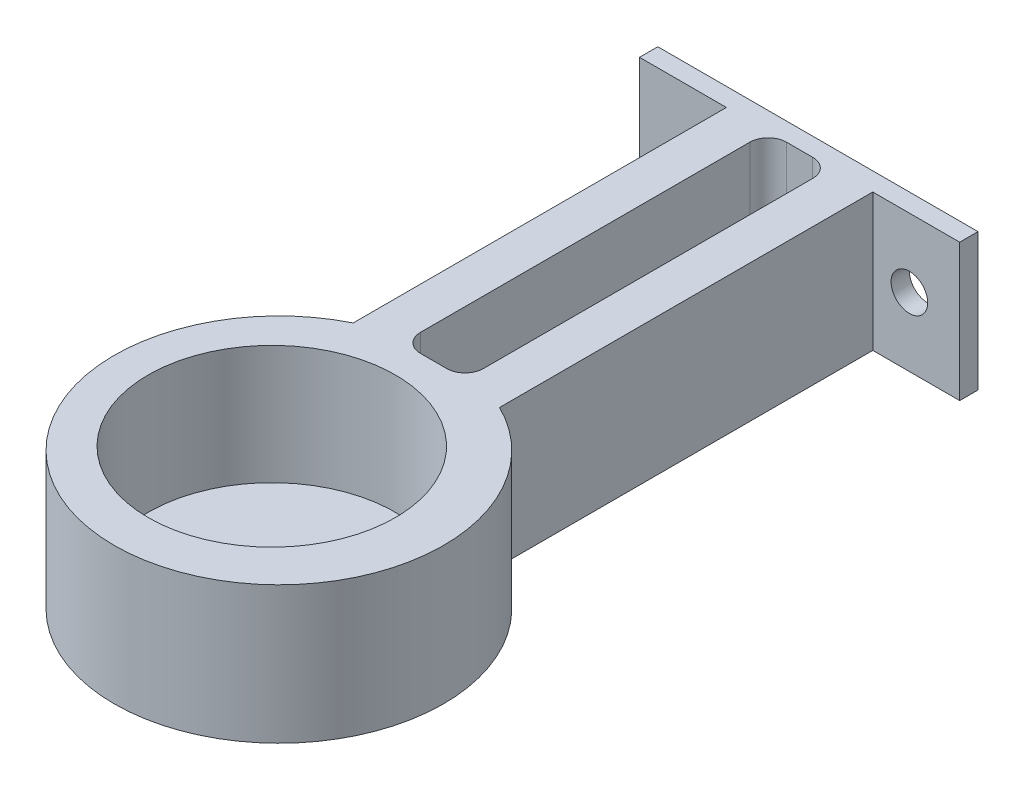
from build123d import *

# Parameters (mm, degrees)
EXTRUDE_1_DEPTH     = 15
SKETCH_3_W          = 16
SKETCH_3_H          = 15
EXTRUDE_2_DEPTH     = 4
SKETCH_2_R          = 13.51
CUT_EXTRUDE_2_DEPTH = 13
SKETCH_4_W          = 4.565228969
SKETCH_4_H          = 15
EXTRUDE_3_DEPTH     = 40
FILLET_2_R          = 2
SKETCH_5_R          = 2
EXTRUDE_4_DEPTH     = 2
FILLET_3_R          = 2


with BuildPart() as part:
    # 草图1 → 凸台-拉伸1 (new body)
    with BuildSketch(Plane(origin=(0, 0, 0), x_dir=(1, 0, 0), z_dir=(0, 1, 0))):
        with BuildLine():
            Line((6.148844254, 16.917201729), (-6.148844254, 16.917201729))
            ThreePointArc((-6.148844254, 16.917201729), (0, -18), (6.148844254, 16.917201729))
        make_face()
    extrude(amount=EXTRUDE_1_DEPTH)

    # 草图3 → 凸台-拉伸2 (add)
    with BuildSketch(Plane(origin=(0, 0, -16.917201729), x_dir=(-1, 0, 0), z_dir=(0, 0, -1))):
        with Locations((0, 7.5)):
            Rectangle(SKETCH_3_W, SKETCH_3_H)
    extrude(amount=-EXTRUDE_2_DEPTH)

    # 草图2 → 切除-拉伸2 (cut)
    with BuildSketch(Plane(origin=(0, 15, 0), x_dir=(1, 0, 0), z_dir=(0, 1, 0))):
        with Locations(Location((-0.775740082, 0, 0), (0, 0, 270))):
            Circle(SKETCH_2_R)
    extrude(amount=-CUT_EXTRUDE_2_DEPTH, mode=Mode.SUBTRACT)

    # 草图4 → 凸台-拉伸3 (add)
    with BuildSketch(Plane(origin=(0, 0, -16.917201729), x_dir=(-1, 0, 0), z_dir=(0, 0, -1))):
        with Locations((5.717385516, 7.5)):
            Rectangle(SKETCH_4_W, SKETCH_4_H)
        with Locations((-5.717385516, 7.5)):
            Rectangle(SKETCH_4_W, SKETCH_4_H)
    extrude(amount=EXTRUDE_3_DEPTH)

    # 圆角2
    fillet_2_edges = [part.edges().sort_by_distance(p)[0] for p in [
        (-3.434771031, 7.5, -16.917201729),
        (3.434771031, 7.5, -16.917201729),
    ]]
    fillet(fillet_2_edges, radius=FILLET_2_R)

    # 草图5 → 凸台-拉伸4 (add)
    with BuildSketch(Plane(origin=(0, 0, -56.917201729), x_dir=(-1, 0, 0), z_dir=(0, 0, -1))):
        Polygon((-17.5, 0), (-17.5, 15), (12.5, 15), (17.5, 15), (17.5, 0), (8, 0), align=None)
        with Locations((-12, 7.5)):
            Circle(SKETCH_5_R, mode=Mode.SUBTRACT)
        with Locations((12, 7.5)):
            Circle(SKETCH_5_R, mode=Mode.SUBTRACT)
    extrude(amount=EXTRUDE_4_DEPTH)

    # 圆角3
    fillet_3_edges = [part.edges().sort_by_distance(p)[0] for p in [
        (-3.434771031, 7.5, -56.917201729),
        (3.434771031, 7.5, -56.917201729),
    ]]
    fillet(fillet_3_edges, radius=FILLET_3_R)


solid = part.part
